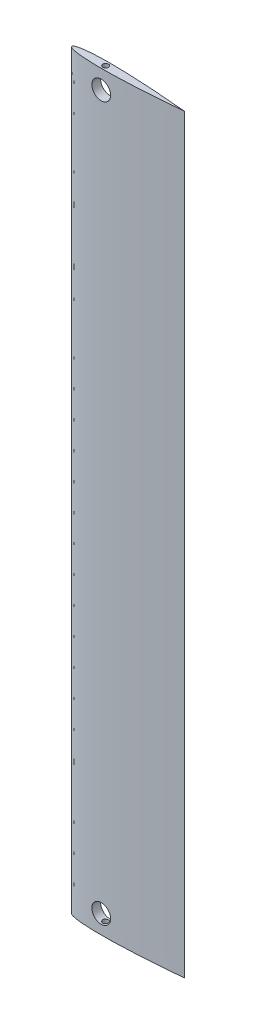
from build123d import *

# Parameters (mm, degrees)
EXTRUDE_1_DEPTH     = 200
SKETCH_3_R          = 5
CUT_EXTRUDE_1_DEPTH = 20
SKETCH_4_R          = 1.5
CUT_EXTRUDE_2_DEPTH = 10


with BuildPart() as part:
    # 草图1 → 凸台-拉伸1 (new body)
    with BuildSketch(Plane(origin=(0, 0, 0), x_dir=(1, 0, 0), z_dir=(0, 1, 0))):
        with BuildLine():
            add(Edge.make_bspline(
                [(0, 0), (5.2949e-05, 0.034695622), (0.004976604, 0.079744224), (0.019675034, 0.136489483), (0.050833594, 0.207649815), (0.082654776, 0.263372174), (0.129734096, 0.328018437), (0.199935078, 0.404706809), (0.303219968, 0.495530655), (0.466967128, 0.610670013), (0.746191512, 0.765206224), (1.26166456, 0.981640284), (2.242007, 1.278419353), (4.14663612, 1.666769693), (7.096539488, 2.028527597), (10.956831422, 2.287877156), (15.47888885, 2.410797869), (20.175207395, 2.408298517), (24.867966532, 2.311671349), (29.562682568, 2.144218739), (33.662022755, 1.950168416), (37.18465387, 1.755215969), (40.102786331, 1.577879963), (42.465913857, 1.423968638), (44.770134878, 1.266849828), (47.173435556, 1.091460443), (49.988370897, 0.879733124), (53.111581269, 0.6234817), (55.721125403, 0.401565298), (58.414982765, 0.151678391), (59.468738841, 0.051479206), (60, 0)],
                knots=[0, 0, 0, 0, 0, 0.002066404, 0.00272166, 0.00349439, 0.00465466, 0.005910137, 0.007512176, 0.009723538, 0.012894752, 0.017904229, 0.026634222, 0.043223315, 0.074288463, 0.134448605, 0.204905617, 0.275362631, 0.345819646, 0.416276661, 0.486733677, 0.557190692, 0.5924192, 0.627647708, 0.662876215, 0.698104723, 0.733333231, 0.768561739, 0.839018753, 0.874247262, 0.90947577, 0.90947577, 0.90947577, 0.90947577, 0.90947577], degree=4))
            add(Edge.make_bspline(
                [(0, 0), (5.2949e-05, -0.034695622), (0.004976604, -0.079744224), (0.019675034, -0.136489483), (0.050833594, -0.207649815), (0.082654776, -0.263372174), (0.129734096, -0.328018437), (0.199935078, -0.404706809), (0.303219968, -0.495530655), (0.466967128, -0.610670013), (0.746191512, -0.765206224), (1.26166456, -0.981640284), (2.242007, -1.278419353), (4.14663612, -1.666769693), (7.096539488, -2.028527597), (10.956831422, -2.287877156), (15.47888885, -2.410797869), (20.175207395, -2.408298517), (24.867966532, -2.311671349), (29.562682568, -2.144218739), (33.662022755, -1.950168416), (37.18465387, -1.755215969), (40.102786331, -1.577879963), (42.465913857, -1.423968638), (44.770134878, -1.266849828), (47.173435556, -1.091460443), (49.988370897, -0.879733124), (53.111581269, -0.6234817), (55.721125403, -0.401565298), (58.414982765, -0.151678391), (59.468738841, -0.051479206), (60, 0)],
                knots=[0, 0, 0, 0, 0, 0.002066404, 0.00272166, 0.00349439, 0.00465466, 0.005910137, 0.007512176, 0.009723538, 0.012894752, 0.017904229, 0.026634222, 0.043223315, 0.074288463, 0.134448605, 0.204905617, 0.275362631, 0.345819646, 0.416276661, 0.486733677, 0.557190692, 0.5924192, 0.627647708, 0.662876215, 0.698104723, 0.733333231, 0.768561739, 0.839018753, 0.874247262, 0.90947577, 0.90947577, 0.90947577, 0.90947577, 0.90947577], degree=4))
        make_face()
    extrude_1 = extrude(amount=EXTRUDE_1_DEPTH)

    # 草图3 → 切除-拉伸1 (cut, symmetric)
    with BuildSketch(Plane.XY):
        with Locations((18, 10)):
            Circle(SKETCH_3_R)
    cut_extrude_1 = extrude(amount=CUT_EXTRUDE_1_DEPTH, both=True, mode=Mode.SUBTRACT)

    # 草图4 → 切除-拉伸2 (cut)
    with BuildSketch(Plane.XZ):
        with Locations(Location((18, 0, 0), (0, 0, 270))):
            Circle(SKETCH_4_R)
    cut_extrude_2 = extrude(amount=-CUT_EXTRUDE_2_DEPTH, mode=Mode.SUBTRACT)

    # 镜向1: 凸台-拉伸1, 切除-拉伸1, 切除-拉伸2 across plane
    add(extrude_1.mirror(Plane(origin=(29.775929057, 200, 2.123918129), x_dir=(0, 0, 1), z_dir=(0, -1, 0))))
    add(cut_extrude_1.mirror(Plane(origin=(29.775929057, 200, 2.123918129), x_dir=(0, 0, 1), z_dir=(0, -1, 0))), mode=Mode.SUBTRACT)
    add(cut_extrude_2.mirror(Plane(origin=(29.775929057, 200, 2.123918129), x_dir=(0, 0, 1), z_dir=(0, -1, 0))), mode=Mode.SUBTRACT)


solid = part.part
